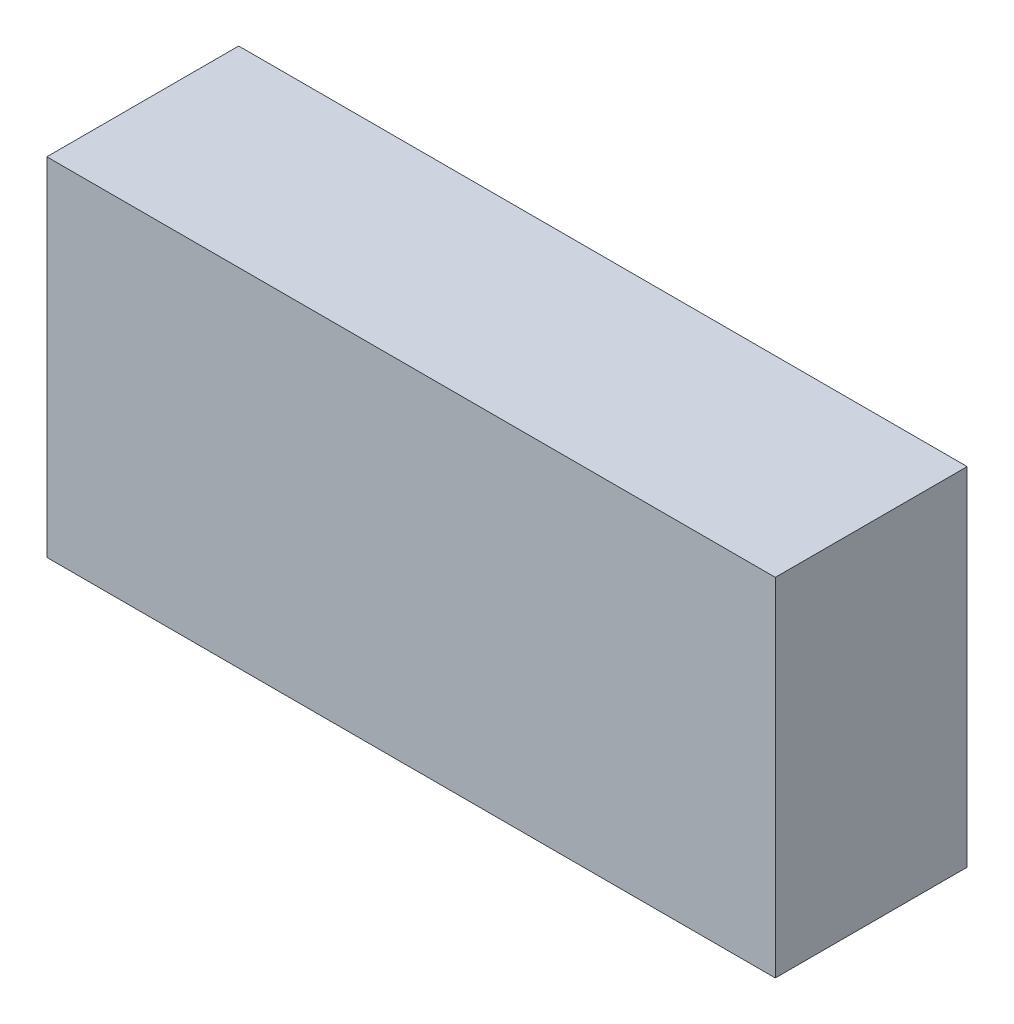
from build123d import *

# Parameters (mm, degrees)
SKETCH1_W               = 3.7968
SKETCH1_H               = 1.8084
COMPONENT_OUTLINE_DEPTH = 1


with BuildPart() as part:
    # Sketch1 → Component_Outline (new body)
    with BuildSketch(Plane.XY):
        with Locations((0, 0.0042)):
            Rectangle(SKETCH1_W, SKETCH1_H)
    extrude(amount=COMPONENT_OUTLINE_DEPTH)


solid = part.part
